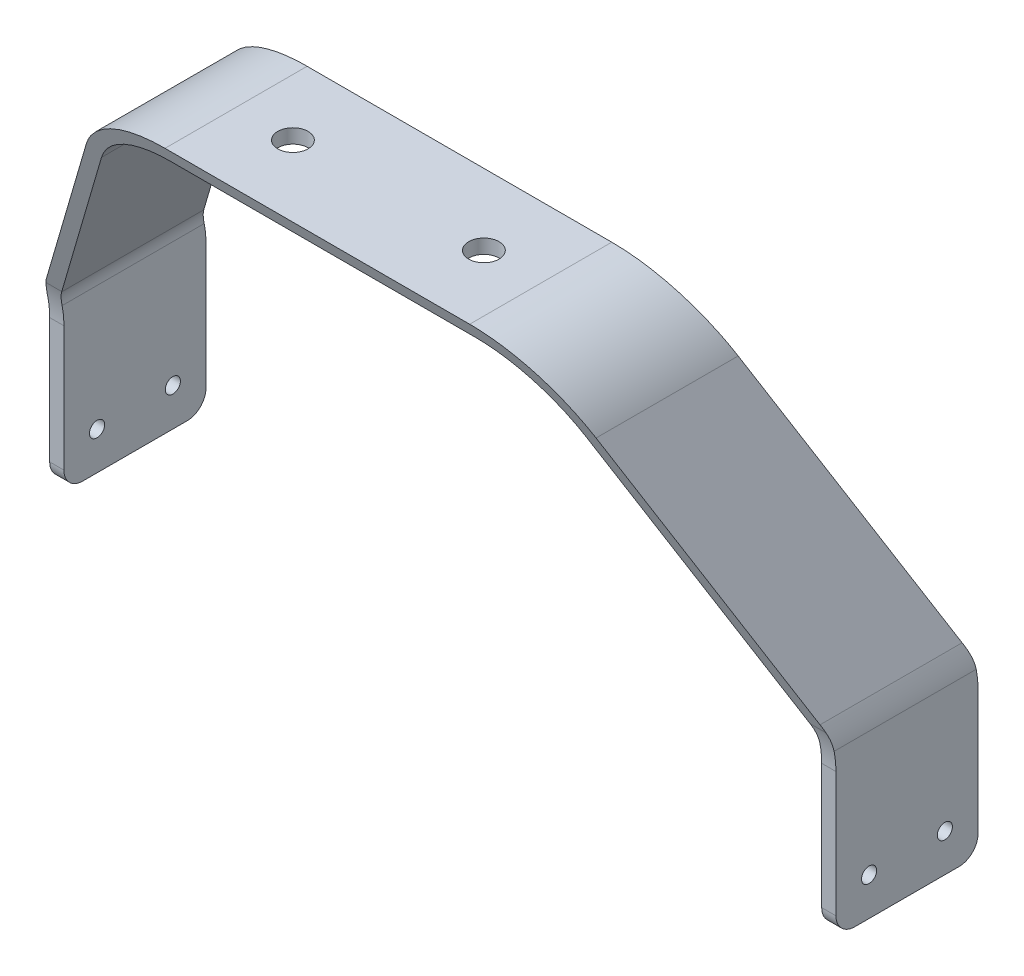
from build123d import *

# Parameters (mm, degrees)
BOSS_EXTRUDE4_DEPTH      = 40
BOSS_EXTRUDE4_DEPTH_BACK = 20
SKETCH5_OUTSIDE_W        = 102.574
SKETCH5_OUTSIDE_H        = 142.574
CUT_EXTRUDE1_DEPTH       = 348.961204734
SKETCH6_R                = 1.6
CUT_EXTRUDE2_DEPTH       = 346.049136601
FILLET1_R                = 4
SKETCH7_R                = 3.2
CUT_EXTRUDE3_DEPTH       = 3


with BuildPart() as part:
    # Sketch4 → Boss-Extrude4 (new, two sides: drawn at the far end of the back side and taken through both)
    with BuildSketch(Plane(origin=(0, 0, -249), x_dir=(-1, 0, 0), z_dir=(0, 0, -1)).offset(-BOSS_EXTRUDE4_DEPTH_BACK)):
        with BuildLine():
            Line((-83, 0), (-83, 34.267002189))
            ThreePointArc((-83, 34.267002189), (-82.659258263, 36.85519264), (-81.660254038, 39.267002189))
            Line((-81.660254038, 39.267002189), (-53.812919768, 87.5))
            ThreePointArc((-53.812919768, 87.5), (-44.662284673, 96.650635095), (-32.162284673, 100))
            Line((-32.162284673, 100), (0, 100))
            Line((0, 100), (32.162284673, 100))
            ThreePointArc((32.162284673, 100), (44.662284673, 96.650635095), (53.812919768, 87.5))
            Line((53.812919768, 87.5), (81.660254038, 39.267002189))
            ThreePointArc((81.660254038, 39.267002189), (82.659258263, 36.85519264), (83, 34.267002189))
            Line((83, 34.267002189), (83, 0))
            Line((83, 0), (80, 0))
            Line((80, 0), (80, 34.267002189))
            ThreePointArc((80, 34.267002189), (79.761480784, 36.078735505), (79.062177826, 37.767002189))
            Line((79.062177826, 37.767002189), (51.214843556, 86))
            ThreePointArc((51.214843556, 86), (43.162284673, 94.052558883), (32.162284673, 97))
            Line((32.162284673, 97), (0, 97))
            Line((0, 97), (-32.162284673, 97))
            ThreePointArc((-32.162284673, 97), (-43.162284673, 94.052558883), (-51.214843556, 86))
            Line((-51.214843556, 86), (-79.062177826, 37.767002189))
            ThreePointArc((-79.062177826, 37.767002189), (-79.761480784, 36.078735505), (-80, 34.267002189))
            Line((-80, 34.267002189), (-80, 0))
            Line((-80, 0), (-83, 0))
        make_face()
    extrude(amount=BOSS_EXTRUDE4_DEPTH + BOSS_EXTRUDE4_DEPTH_BACK)

    # Sketch5 outside → Cut-Extrude1 (cut, through all)
    with BuildSketch(Plane(origin=(83, 0, 0), x_dir=(0, 0, -1), z_dir=(1, 0, 0))):
        with Locations((259, 50)):
            Rectangle(SKETCH5_OUTSIDE_W, SKETCH5_OUTSIDE_H)
        with BuildLine():
            Line((229, 100), (254.037739827, 37.863968909))
            ThreePointArc((254.037739827, 37.863968909), (255.121445979, 34.196094194), (255.487139078, 30.388996545))
            Line((255.487139078, 30.388996545), (255.487139078, 0))
            Line((255.487139078, 0), (285.487139078, 0))
            Line((285.487139078, 0), (285.487139078, 30.388996545))
            ThreePointArc((285.487139078, 30.388996545), (285.121445979, 34.196094194), (284.037739827, 37.863968909))
            Line((284.037739827, 37.863968909), (259, 100))
            Line((259, 100), (229, 100))
        make_face(mode=Mode.SUBTRACT)
    extrude(amount=-CUT_EXTRUDE1_DEPTH, mode=Mode.SUBTRACT)

    # Sketch6 → Cut-Extrude2 (cut, through all)
    with BuildSketch(Plane(origin=(83, 0, 0), x_dir=(0, 0, -1), z_dir=(1, 0, 0))):
        with Locations((262.487139078, 8)):
            Circle(SKETCH6_R)
        with Locations((278.487139078, 8)):
            Circle(SKETCH6_R)
    extrude(amount=-CUT_EXTRUDE2_DEPTH, mode=Mode.SUBTRACT)

    # Fillet1
    fillet1_edges = [part.edges().sort_by_distance(p)[0] for p in [
        (81.5, 0, -285.487139078),
        (-81.5, 0, -285.487139078),
        (81.5, 0, -255.487139078),
        (-81.5, 0, -255.487139078),
    ]]
    fillet(fillet1_edges, radius=FILLET1_R)

    # Sketch7 → Cut-Extrude3 (cut)
    with BuildSketch(Plane(origin=(0, 100, 0), x_dir=(1, 0, 0), z_dir=(0, 1, 0))):
        with Locations(Location((-20.162284673, 244, 0), (0, 0, 270))):
            Circle(SKETCH7_R)
        with Locations(Location((20.162284673, 244, 0), (0, 0, 270))):
            Circle(SKETCH7_R)
    extrude(amount=-CUT_EXTRUDE3_DEPTH, mode=Mode.SUBTRACT)


solid = part.part
